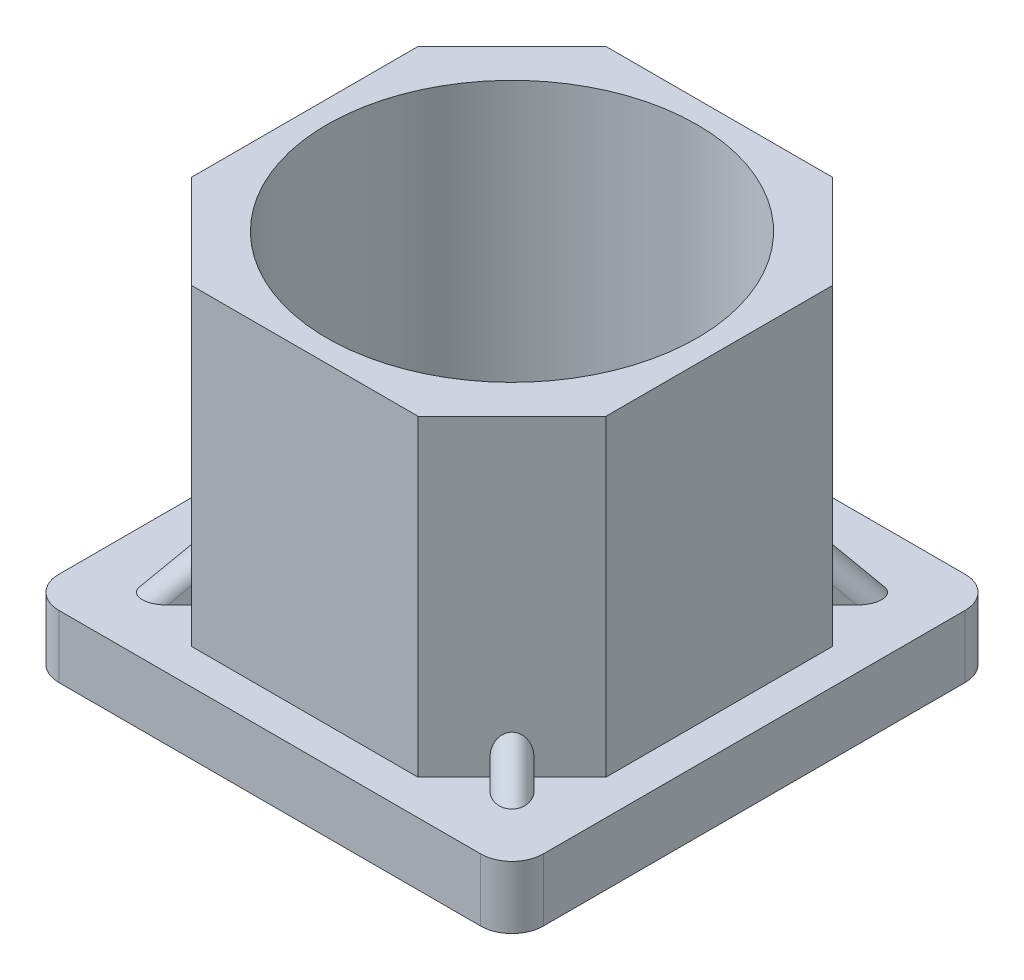
from build123d import *
from build123d.topology import SkipClean

# Parameters (mm, degrees)
BOSS_EXTRU_1_DEPTH                  = 8
BOSS_EXTRU_2_DEPTH                  = 40
ENL_V_MAT_EXTRU_1_DEPTH             = 65.998155358
ENL_V_MAT_EXTRU_1_DEPTH_BACK        = 65.998155358
ESQUISSE5_R                         = 23.67
CHANFREIN1_SIZE                     = 1.75
BOSS_EXTRU_3_DEPTH                  = 2
BOSS_EXTRU_4_DEPTH                  = 2
ENL_V_MAT_EXTRU_4_REACH             = 81.818
ENL_V_MAT_EXTRU_4_DIRECTION_2_REACH = 81.818
ENL_V_MAT_EXTRU_6_REACH             = 81.818
ENL_V_MAT_EXTRU_6_DIRECTION_2_REACH = 81.818
ENL_V_MAT_EXTRU_7_REACH             = 81.818
ENL_V_MAT_EXTRU_7_DIRECTION_2_REACH = 81.818
ENL_V_MAT_EXTRU_8_REACH             = 81.818
ENL_V_MAT_EXTRU_8_DIRECTION_2_REACH = 81.818


with BuildPart() as part:
    # Esquisse1 → Boss.-Extru.1 (new body)
    with BuildSketch(Plane(origin=(0, 0, 0), x_dir=(1, 0, 0), z_dir=(0, 1, 0))):
        with BuildLine():
            Line((-26.99, -30.99), (26.99, -30.99))
            ThreePointArc((26.99, -30.99), (29.818427125, -29.818427125), (30.99, -26.99))
            Line((30.99, -26.99), (30.99, 26.99))
            ThreePointArc((30.99, 26.99), (29.818427125, 29.818427125), (26.99, 30.99))
            Line((26.99, 30.99), (-26.99, 30.99))
            ThreePointArc((-26.99, 30.99), (-29.818427125, 29.818427125), (-30.99, 26.99))
            Line((-30.99, 26.99), (-30.99, -26.99))
            ThreePointArc((-30.99, -26.99), (-29.818427125, -29.818427125), (-26.99, -30.99))
        make_face()
    extrude(amount=BOSS_EXTRU_1_DEPTH)

    # Esquisse4 → Boss.-Extru.2 (add)
    with BuildSketch(Plane(origin=(0, 8, 0), x_dir=(1, 0, 0), z_dir=(0, 1, 0))):
        Polygon((-26.5, 14.47918472), (-14.47918472, 26.5), (14.47918472, 26.5), (26.5, 14.47918472), (26.5, -14.47918472), (14.47918472, -26.5), (-14.47918472, -26.5), (-26.5, -14.47918472), align=None)
    extrude(amount=BOSS_EXTRU_2_DEPTH)

    # Esquisse5 → Enlèv. mat.-Extru.1 (cut, two sides: drawn at the far end of the back side and taken through both)
    with BuildSketch(Plane(origin=(0, 48, 0), x_dir=(1, 0, 0), z_dir=(0, 1, 0)).offset(-ENL_V_MAT_EXTRU_1_DEPTH_BACK)):
        Circle(ESQUISSE5_R)
    extrude(amount=ENL_V_MAT_EXTRU_1_DEPTH + ENL_V_MAT_EXTRU_1_DEPTH_BACK, mode=Mode.SUBTRACT)

    # Chanfrein1
    chanfrein1_edges = [part.edges().sort_by_distance(p)[0] for p in [
        (-23.67, 0, 0),
    ]]
    chamfer(chanfrein1_edges, length=CHANFREIN1_SIZE)

    # Esquisse10 → Boss.-Extru.3 (add, symmetric)
    with BuildSketch(Plane(origin=(0, 0, 0), x_dir=(-0.7071067811865478, 0, -0.7071067811865472), z_dir=(0.7071067811865472, 0, -0.7071067811865478))):
        Polygon((-35.969720461, 6), (-28.969720461, 13), (-28.969720461, 6), align=None)
        Polygon((28.976659403, 15), (35.976659403, 8), (28.976659403, 8), align=None)
    extrude(amount=BOSS_EXTRU_3_DEPTH, both=True)

    # Esquisse11 → Boss.-Extru.4 (add, symmetric)
    with BuildSketch(Plane(origin=(0, 0, 0), x_dir=(0.7071067811865366, 0, -0.7071067811865585), z_dir=(0.7071067811865585, 0, 0.7071067811865366))):
        Polygon((-35.975, 6), (-28.975, 13), (-28.975, 6), align=None)
        Polygon((35.975, 6), (28.975, 13), (28.975, 6), align=None)
    extrude(amount=BOSS_EXTRU_4_DEPTH, both=True)

    # Enlèv. mat.-Extru.4: up to this plane
    enl_v_mat_extru_4_end = Plane(origin=(14.47918472, 48, -26.5), z_dir=(-0.7071067811865497, 0, 0.7071067811865456))
    # Esquisse13 → Enlèv. mat.-Extru.4 (cut, up to the surface)
    with BuildSketch(Plane(origin=(7.416369055, -10.488329701, -7.416369055), x_dir=(-0.8660254037844379, -0.4082482904638646, -0.2886751345948132), z_dir=(0.5000000000000014, -0.7071067811865476, -0.49999999999999856)), mode=Mode.PRIVATE) as enl_v_mat_extru_4_sk1:
        with BuildLine():
            Line((-15.50322883, 25.388978088), (-17.136222001, 24.234277543))
            ThreePointArc((-17.136222001, 24.234277543), (-15.666955767, 24.576563109), (-14.376367648, 23.795355721))
            Line((-14.376367648, 23.795355721), (-15.50322883, 25.388978088))
        make_face()
    enl_v_mat_extru_4_tool1 = split(extrude(enl_v_mat_extru_4_sk1.sketch, amount=-ENL_V_MAT_EXTRU_4_REACH, mode=Mode.PRIVATE), bisect_by=enl_v_mat_extru_4_end, keep=Keep.BOTH, mode=Mode.PRIVATE)
    add(enl_v_mat_extru_4_tool1.solids().sort_by_distance((20.935486, 10.183705, -23.131924))[0], mode=Mode.SUBTRACT)
    # Esquisse13 → Enlèv. mat.-Extru.4 (cut, up to the surface)
    with BuildSketch(Plane(origin=(7.416369055, -10.488329701, -7.416369055), x_dir=(-0.8660254037844379, -0.4082482904638646, -0.2886751345948132), z_dir=(0.5000000000000014, -0.7071067811865476, -0.49999999999999856)), mode=Mode.PRIVATE) as enl_v_mat_extru_4_sk2:
        with BuildLine():
            Line((-18.769215154, 23.079577011), (-17.642353972, 21.485954644))
            ThreePointArc((-17.642353972, 21.485954644), (-17.948687323, 22.963135244), (-17.136222001, 24.234277543))
            Line((-17.136222001, 24.234277543), (-18.769215154, 23.079577011))
        make_face()
    enl_v_mat_extru_4_tool2 = split(extrude(enl_v_mat_extru_4_sk2.sketch, amount=-ENL_V_MAT_EXTRU_4_REACH, mode=Mode.PRIVATE), bisect_by=enl_v_mat_extru_4_end, keep=Keep.BOTH, mode=Mode.PRIVATE)
    add(enl_v_mat_extru_4_tool2.solids().sort_by_distance((23.131924, 10.183705, -20.935486))[0], mode=Mode.SUBTRACT)

    # Enlèv. mat.-Extru.4 direction 2: up to this plane
    enl_v_mat_extru_4_direction_2_end = Plane(origin=(-26.99, 8, 26.99), z_dir=(0, -1, 0))
    # Esquisse13 → Enlèv. mat.-Extru.4 direction 2 (cut, up to the surface)
    with BuildSketch(Plane(origin=(7.416369055, -10.488329701, -7.416369055), x_dir=(-0.8660254037844379, -0.4082482904638646, -0.2886751345948132), z_dir=(0.5000000000000014, -0.7071067811865476, -0.49999999999999856)), mode=Mode.PRIVATE) as enl_v_mat_extru_4_direction_2_sk1:
        with BuildLine():
            Line((-15.50322883, 25.388978088), (-17.136222001, 24.234277543))
            ThreePointArc((-17.136222001, 24.234277543), (-15.666955767, 24.576563109), (-14.376367648, 23.795355721))
            Line((-14.376367648, 23.795355721), (-15.50322883, 25.388978088))
        make_face()
    enl_v_mat_extru_4_direction_2_tool1 = split(extrude(enl_v_mat_extru_4_direction_2_sk1.sketch, amount=ENL_V_MAT_EXTRU_4_DIRECTION_2_REACH, mode=Mode.PRIVATE), bisect_by=enl_v_mat_extru_4_direction_2_end, keep=Keep.BOTH, mode=Mode.PRIVATE)
    add(enl_v_mat_extru_4_direction_2_tool1.solids().sort_by_distance((20.935486, 10.183705, -23.131924))[0], mode=Mode.SUBTRACT)
    # Esquisse13 → Enlèv. mat.-Extru.4 direction 2 (cut, up to the surface)
    with BuildSketch(Plane(origin=(7.416369055, -10.488329701, -7.416369055), x_dir=(-0.8660254037844379, -0.4082482904638646, -0.2886751345948132), z_dir=(0.5000000000000014, -0.7071067811865476, -0.49999999999999856)), mode=Mode.PRIVATE) as enl_v_mat_extru_4_direction_2_sk2:
        with BuildLine():
            Line((-18.769215154, 23.079577011), (-17.642353972, 21.485954644))
            ThreePointArc((-17.642353972, 21.485954644), (-17.948687323, 22.963135244), (-17.136222001, 24.234277543))
            Line((-17.136222001, 24.234277543), (-18.769215154, 23.079577011))
        make_face()
    enl_v_mat_extru_4_direction_2_tool2 = split(extrude(enl_v_mat_extru_4_direction_2_sk2.sketch, amount=ENL_V_MAT_EXTRU_4_DIRECTION_2_REACH, mode=Mode.PRIVATE), bisect_by=enl_v_mat_extru_4_direction_2_end, keep=Keep.BOTH, mode=Mode.PRIVATE)
    add(enl_v_mat_extru_4_direction_2_tool2.solids().sort_by_distance((23.131924, 10.183705, -20.935486))[0], mode=Mode.SUBTRACT)

    # Enlèv. mat.-Extru.6: up to this plane
    enl_v_mat_extru_6_end = Plane(origin=(-26.5, 48, -14.47918472), z_dir=(0.7071067811865476, 0, 0.7071067811865476))
    # Esquisse15 → Enlèv. mat.-Extru.6 (cut, up to the surface)
    with BuildSketch(Plane(origin=(-7.416369055, -10.488329701, -7.416369055), x_dir=(-0.8660254037844388, 0.40824829046386296, 0.28867513459481287), z_dir=(-0.4999999999999999, -0.7071067811865477, -0.5)), mode=Mode.PRIVATE) as enl_v_mat_extru_6_sk1:
        with BuildLine():
            Line((14.187416942, 23.52813907), (16.32040286, 26.544636683))
            Line((16.32040286, 26.544636683), (19.586389183, 24.235235606))
            Line((19.586389183, 24.235235606), (17.453403266, 21.218737993))
            ThreePointArc((17.453403266, 21.218737993), (16.919004437, 23.927085537), (14.187416942, 23.52813907))
        make_face()
    enl_v_mat_extru_6_tool1 = split(extrude(enl_v_mat_extru_6_sk1.sketch, amount=-ENL_V_MAT_EXTRU_6_REACH, mode=Mode.PRIVATE), bisect_by=enl_v_mat_extru_6_end, keep=Keep.BOTH, mode=Mode.PRIVATE)
    add(enl_v_mat_extru_6_tool1.solids().sort_by_distance((-22.387383, 10.683882, -22.387383))[0], mode=Mode.SUBTRACT)

    # Enlèv. mat.-Extru.6 direction 2: up to this plane
    enl_v_mat_extru_6_direction_2_end = Plane(origin=(-26.99, 8, 26.99), z_dir=(0, -1, 0))
    # Esquisse15 → Enlèv. mat.-Extru.6 direction 2 (cut, up to the surface)
    with BuildSketch(Plane(origin=(-7.416369055, -10.488329701, -7.416369055), x_dir=(-0.8660254037844388, 0.40824829046386296, 0.28867513459481287), z_dir=(-0.4999999999999999, -0.7071067811865477, -0.5)), mode=Mode.PRIVATE) as enl_v_mat_extru_6_direction_2_sk1:
        with BuildLine():
            Line((14.187416942, 23.52813907), (16.32040286, 26.544636683))
            Line((16.32040286, 26.544636683), (19.586389183, 24.235235606))
            Line((19.586389183, 24.235235606), (17.453403266, 21.218737993))
            ThreePointArc((17.453403266, 21.218737993), (16.919004437, 23.927085537), (14.187416942, 23.52813907))
        make_face()
    enl_v_mat_extru_6_direction_2_tool1 = split(extrude(enl_v_mat_extru_6_direction_2_sk1.sketch, amount=ENL_V_MAT_EXTRU_6_DIRECTION_2_REACH, mode=Mode.PRIVATE), bisect_by=enl_v_mat_extru_6_direction_2_end, keep=Keep.BOTH, mode=Mode.PRIVATE)
    add(enl_v_mat_extru_6_direction_2_tool1.solids().sort_by_distance((-22.387383, 10.683882, -22.387383))[0], mode=Mode.SUBTRACT)

    # Enlèv. mat.-Extru.7: up to this plane
    enl_v_mat_extru_7_end = Plane(origin=(-14.47918472, 48, 26.5), z_dir=(0.7071067811865447, 0, -0.7071067811865503))
    # Esquisse16 → Enlèv. mat.-Extru.7 (cut, up to the surface)
    with BuildSketch(Plane(origin=(-7.416369055, -10.488329701, 7.416369055), x_dir=(-0.8660254037844398, 0.4082482904638608, -0.2886751345948125), z_dir=(-0.499999999999998, -0.7071067811865477, 0.500000000000002)), mode=Mode.PRIVATE) as enl_v_mat_extru_7_sk1:
        with BuildLine():
            Line((15.50322883, -25.388978088), (17.136221984, -24.234277555))
            ThreePointArc((17.136221984, -24.234277555), (15.643317492, -24.572481506), (14.348528292, -23.755984926))
            Line((14.348528292, -23.755984926), (15.50322883, -25.388978088))
        make_face()
    enl_v_mat_extru_7_tool1 = split(extrude(enl_v_mat_extru_7_sk1.sketch, amount=-ENL_V_MAT_EXTRU_7_REACH, mode=Mode.PRIVATE), bisect_by=enl_v_mat_extru_7_end, keep=Keep.BOTH, mode=Mode.PRIVATE)
    add(enl_v_mat_extru_7_tool1.solids().sort_by_distance((-20.935081, 10.18328, 23.131728))[0], mode=Mode.SUBTRACT)
    # Esquisse16 → Enlèv. mat.-Extru.7 (cut, up to the surface)
    with BuildSketch(Plane(origin=(-7.416369055, -10.488329701, 7.416369055), x_dir=(-0.8660254037844398, 0.4082482904638608, -0.2886751345948125), z_dir=(-0.499999999999998, -0.7071067811865477, 0.500000000000002)), mode=Mode.PRIVATE) as enl_v_mat_extru_7_sk2:
        with BuildLine():
            Line((18.769215154, -23.079577011), (17.614514616, -21.446583849))
            ThreePointArc((17.614514616, -21.446583849), (17.952718572, -22.93948835), (17.136221984, -24.234277555))
            Line((17.136221984, -24.234277555), (18.769215154, -23.079577011))
        make_face()
    enl_v_mat_extru_7_tool2 = split(extrude(enl_v_mat_extru_7_sk2.sketch, amount=-ENL_V_MAT_EXTRU_7_REACH, mode=Mode.PRIVATE), bisect_by=enl_v_mat_extru_7_end, keep=Keep.BOTH, mode=Mode.PRIVATE)
    add(enl_v_mat_extru_7_tool2.solids().sort_by_distance((-23.131728, 10.18328, 20.935081))[0], mode=Mode.SUBTRACT)

    # Enlèv. mat.-Extru.7 direction 2: up to this plane
    with SkipClean():  # the faces are left unmerged after this step: merging them gives an invalid solid
        enl_v_mat_extru_7_direction_2_end = Plane(origin=(-26.99, 8, 26.99), z_dir=(0, -1, 0))
        # Esquisse16 → Enlèv. mat.-Extru.7 direction 2 (cut, up to the surface)
        with BuildSketch(Plane(origin=(-7.416369055, -10.488329701, 7.416369055), x_dir=(-0.8660254037844398, 0.4082482904638608, -0.2886751345948125), z_dir=(-0.499999999999998, -0.7071067811865477, 0.500000000000002)), mode=Mode.PRIVATE) as enl_v_mat_extru_7_direction_2_sk1:
            with BuildLine():
                Line((15.50322883, -25.388978088), (17.136221984, -24.234277555))
                ThreePointArc((17.136221984, -24.234277555), (15.643317492, -24.572481506), (14.348528292, -23.755984926))
                Line((14.348528292, -23.755984926), (15.50322883, -25.388978088))
            make_face()
        enl_v_mat_extru_7_direction_2_tool1 = split(extrude(enl_v_mat_extru_7_direction_2_sk1.sketch, amount=ENL_V_MAT_EXTRU_7_DIRECTION_2_REACH, mode=Mode.PRIVATE), bisect_by=enl_v_mat_extru_7_direction_2_end, keep=Keep.BOTH, mode=Mode.PRIVATE)
        add(enl_v_mat_extru_7_direction_2_tool1.solids().sort_by_distance((-20.935081, 10.18328, 23.131728))[0], mode=Mode.SUBTRACT)
        # Esquisse16 → Enlèv. mat.-Extru.7 direction 2 (cut, up to the surface)
        with BuildSketch(Plane(origin=(-7.416369055, -10.488329701, 7.416369055), x_dir=(-0.8660254037844398, 0.4082482904638608, -0.2886751345948125), z_dir=(-0.499999999999998, -0.7071067811865477, 0.500000000000002)), mode=Mode.PRIVATE) as enl_v_mat_extru_7_direction_2_sk2:
            with BuildLine():
                Line((18.769215154, -23.079577011), (17.614514616, -21.446583849))
                ThreePointArc((17.614514616, -21.446583849), (17.952718572, -22.93948835), (17.136221984, -24.234277555))
                Line((17.136221984, -24.234277555), (18.769215154, -23.079577011))
            make_face()
        enl_v_mat_extru_7_direction_2_tool2 = split(extrude(enl_v_mat_extru_7_direction_2_sk2.sketch, amount=ENL_V_MAT_EXTRU_7_DIRECTION_2_REACH, mode=Mode.PRIVATE), bisect_by=enl_v_mat_extru_7_direction_2_end, keep=Keep.BOTH, mode=Mode.PRIVATE)
        add(enl_v_mat_extru_7_direction_2_tool2.solids().sort_by_distance((-23.131728, 10.18328, 20.935081))[0], mode=Mode.SUBTRACT)

    # Enlèv. mat.-Extru.8: up to this plane
    with SkipClean():  # the faces are left unmerged after this step: merging them gives an invalid solid
        enl_v_mat_extru_8_end = Plane(origin=(26.5, 48, 14.47918472), z_dir=(-0.7071067811865694, 0, -0.7071067811865256))
        # Esquisse12 → Enlèv. mat.-Extru.8 (cut, up to the surface)
        with BuildSketch(Plane(origin=(7.416369055, -10.488329701, 7.416369055), x_dir=(-0.8660254037844298, -0.4082482904638799, 0.2886751345948158), z_dir=(0.5000000000000154, -0.7071067811865477, 0.4999999999999844)), mode=Mode.PRIVATE) as enl_v_mat_extru_8_sk1:
            with BuildLine():
                Line((-18.767059791, -23.076528867), (-17.134066672, -24.231229375))
                ThreePointArc((-17.134066672, -24.231229375), (-17.950563215, -22.936440175), (-17.612359253, -21.443535706))
                Line((-17.612359253, -21.443535706), (-18.767059791, -23.076528867))
            make_face()
        enl_v_mat_extru_8_tool1 = split(extrude(enl_v_mat_extru_8_sk1.sketch, amount=-ENL_V_MAT_EXTRU_8_REACH, mode=Mode.PRIVATE), bisect_by=enl_v_mat_extru_8_end, keep=Keep.BOTH, mode=Mode.PRIVATE)
        add(enl_v_mat_extru_8_tool1.solids().sort_by_distance((23.129862, 10.180641, 20.933214))[0], mode=Mode.SUBTRACT)
        # Esquisse12 → Enlèv. mat.-Extru.8 (cut, up to the surface)
        with BuildSketch(Plane(origin=(7.416369055, -10.488329701, 7.416369055), x_dir=(-0.8660254037844298, -0.4082482904638799, 0.2886751345948158), z_dir=(0.5000000000000154, -0.7071067811865477, 0.4999999999999844)), mode=Mode.PRIVATE) as enl_v_mat_extru_8_sk2:
            with BuildLine():
                Line((-15.501073467, -25.385929944), (-14.346372929, -23.752936782))
                ThreePointArc((-14.346372929, -23.752936782), (-15.64116216, -24.569433368), (-17.134066672, -24.231229375))
                Line((-17.134066672, -24.231229375), (-15.501073467, -25.385929944))
            make_face()
        enl_v_mat_extru_8_tool2 = split(extrude(enl_v_mat_extru_8_sk2.sketch, amount=-ENL_V_MAT_EXTRU_8_REACH, mode=Mode.PRIVATE), bisect_by=enl_v_mat_extru_8_end, keep=Keep.BOTH, mode=Mode.PRIVATE)
        add(enl_v_mat_extru_8_tool2.solids().sort_by_distance((20.933214, 10.180641, 23.129862))[0], mode=Mode.SUBTRACT)

    # Enlèv. mat.-Extru.8 direction 2: up to this plane
    with SkipClean():  # the faces are left unmerged after this step: merging them gives an invalid solid
        enl_v_mat_extru_8_direction_2_end = Plane(origin=(-26.99, 8, 26.99), z_dir=(0, -1, 0))
        # Esquisse12 → Enlèv. mat.-Extru.8 direction 2 (cut, up to the surface)
        with BuildSketch(Plane(origin=(7.416369055, -10.488329701, 7.416369055), x_dir=(-0.8660254037844298, -0.4082482904638799, 0.2886751345948158), z_dir=(0.5000000000000154, -0.7071067811865477, 0.4999999999999844)), mode=Mode.PRIVATE) as enl_v_mat_extru_8_direction_2_sk1:
            with BuildLine():
                Line((-18.767059791, -23.076528867), (-17.134066672, -24.231229375))
                ThreePointArc((-17.134066672, -24.231229375), (-17.950563215, -22.936440175), (-17.612359253, -21.443535706))
                Line((-17.612359253, -21.443535706), (-18.767059791, -23.076528867))
            make_face()
        enl_v_mat_extru_8_direction_2_tool1 = split(extrude(enl_v_mat_extru_8_direction_2_sk1.sketch, amount=ENL_V_MAT_EXTRU_8_DIRECTION_2_REACH, mode=Mode.PRIVATE), bisect_by=enl_v_mat_extru_8_direction_2_end, keep=Keep.BOTH, mode=Mode.PRIVATE)
        add(enl_v_mat_extru_8_direction_2_tool1.solids().sort_by_distance((23.129862, 10.180641, 20.933214))[0], mode=Mode.SUBTRACT)
        # Esquisse12 → Enlèv. mat.-Extru.8 direction 2 (cut, up to the surface)
        with BuildSketch(Plane(origin=(7.416369055, -10.488329701, 7.416369055), x_dir=(-0.8660254037844298, -0.4082482904638799, 0.2886751345948158), z_dir=(0.5000000000000154, -0.7071067811865477, 0.4999999999999844)), mode=Mode.PRIVATE) as enl_v_mat_extru_8_direction_2_sk2:
            with BuildLine():
                Line((-15.501073467, -25.385929944), (-14.346372929, -23.752936782))
                ThreePointArc((-14.346372929, -23.752936782), (-15.64116216, -24.569433368), (-17.134066672, -24.231229375))
                Line((-17.134066672, -24.231229375), (-15.501073467, -25.385929944))
            make_face()
        enl_v_mat_extru_8_direction_2_tool2 = split(extrude(enl_v_mat_extru_8_direction_2_sk2.sketch, amount=ENL_V_MAT_EXTRU_8_DIRECTION_2_REACH, mode=Mode.PRIVATE), bisect_by=enl_v_mat_extru_8_direction_2_end, keep=Keep.BOTH, mode=Mode.PRIVATE)
        add(enl_v_mat_extru_8_direction_2_tool2.solids().sort_by_distance((20.933214, 10.180641, 23.129862))[0], mode=Mode.SUBTRACT)


solid = part.part
